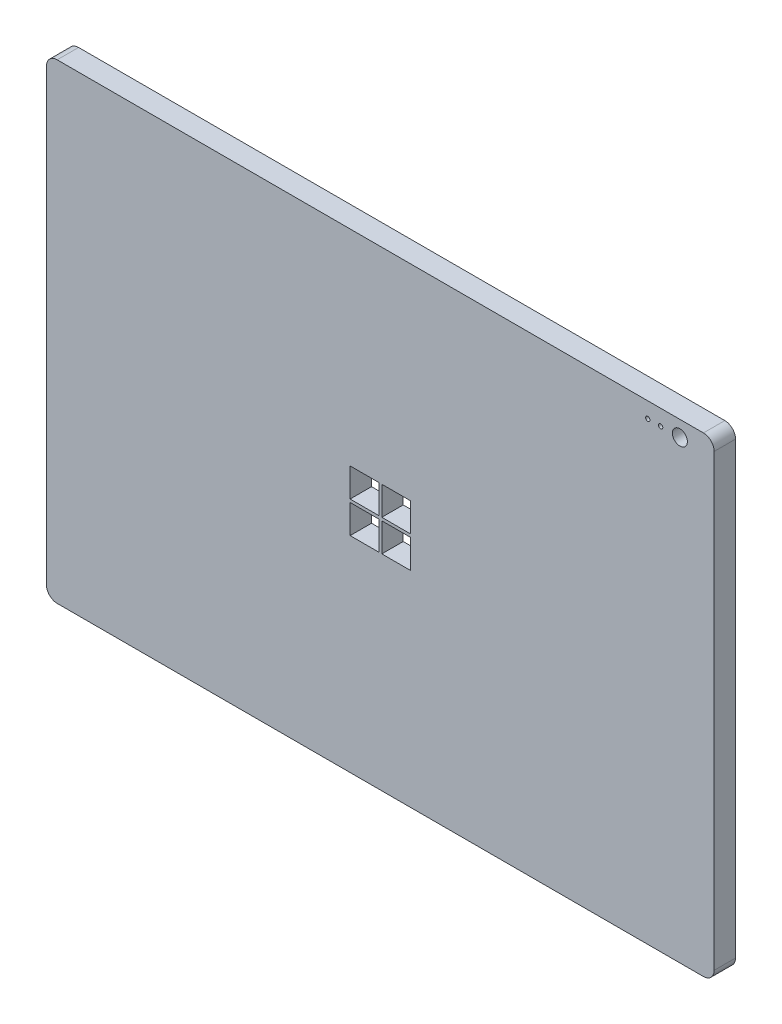
from build123d import *

# Parameters (mm, degrees)
SKETCH1_W           = 312
SKETCH1_H           = 220
SKETCH1_R           = 3.5
SKETCH1_R_2         = 1
SKETCH1_W_2         = 13.4
SKETCH1_H_2         = 13.4
BOSS_EXTRUDE1_DEPTH = 10
FILLET1_R           = 5


with BuildPart() as part:
    # Sketch1 → Boss-Extrude1 (new body)
    with BuildSketch(Plane.XY):
        with Locations((156, 110)):
            Rectangle(SKETCH1_W, SKETCH1_H)
        with Locations((296, 212.7)):
            Circle(SKETCH1_R, mode=Mode.SUBTRACT)
        with Locations((287, 212.7)):
            Circle(SKETCH1_R_2, mode=Mode.SUBTRACT)
        with Locations((281, 212.7)):
            Circle(SKETCH1_R_2, mode=Mode.SUBTRACT)
        with Locations((148.6, 117.4)):
            Rectangle(SKETCH1_W_2, SKETCH1_H_2, mode=Mode.SUBTRACT)
        with Locations((163.4, 117.4)):
            Rectangle(SKETCH1_W_2, SKETCH1_H_2, mode=Mode.SUBTRACT)
        with Locations((148.6, 102.6)):
            Rectangle(SKETCH1_W_2, SKETCH1_H_2, mode=Mode.SUBTRACT)
        with Locations((163.4, 102.6)):
            Rectangle(SKETCH1_W_2, SKETCH1_H_2, mode=Mode.SUBTRACT)
    extrude(amount=BOSS_EXTRUDE1_DEPTH)

    # Fillet1
    fillet1_edges = [part.edges().sort_by_distance(p)[0] for p in [
        (0, 220, 5),
        (312, 220, 5),
        (312, 0, 5),
        (0, 0, 5),
    ]]
    fillet(fillet1_edges, radius=FILLET1_R)


solid = part.part
